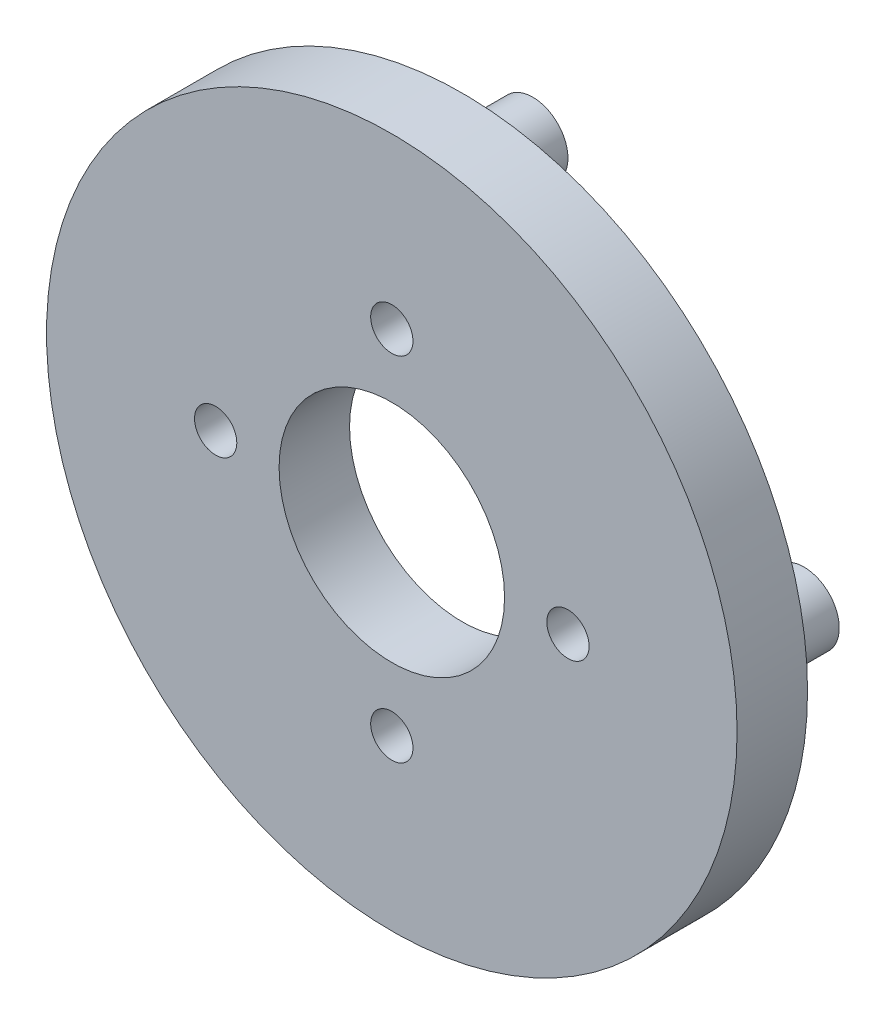
from build123d import *

# Parameters (mm, degrees)
SKETCH_1_R          = 24.5
SKETCH_1_R_2        = 1.5
EXTRUDE_1_DEPTH     = 5
SKETCH_2_R          = 2.5
EXTRUDE_2_DEPTH     = 5
SKETCH_4_R          = 1.25
CUT_EXTRUDE_1_DEPTH = 5
SKETCH_5_R          = 8
CUT_EXTRUDE_2_DEPTH = 5
SKETCH_6_R          = 2.5
CUT_EXTRUDE_3_DEPTH = 2


with BuildPart() as part:
    # 草图1 → 凸台-拉伸1 (new body)
    with BuildSketch(Plane.XY):
        Circle(SKETCH_1_R)
        with Locations((0, 12.5)):
            Circle(SKETCH_1_R_2, mode=Mode.SUBTRACT)
        with Locations((12.5, 0)):
            Circle(SKETCH_1_R_2, mode=Mode.SUBTRACT)
        with Locations((0, -12.5)):
            Circle(SKETCH_1_R_2, mode=Mode.SUBTRACT)
        with Locations((-12.5, 0)):
            Circle(SKETCH_1_R_2, mode=Mode.SUBTRACT)
    extrude(amount=EXTRUDE_1_DEPTH)

    # 草图2 → 凸台-拉伸2 (add)
    with BuildSketch(Plane.XY):
        with Locations((0, 19.25)):
            Circle(SKETCH_2_R)
        with Locations((19.25, 0)):
            Circle(SKETCH_2_R)
        with Locations((0, -19.25)):
            Circle(SKETCH_2_R)
        with Locations((-19.25, 0)):
            Circle(SKETCH_2_R)
    extrude(amount=-EXTRUDE_2_DEPTH)

    # 草图4 → 切除-拉伸1 (cut)
    with BuildSketch(Plane.XY):
        with Locations((0, 19.25)):
            Circle(SKETCH_4_R)
        with Locations((19.25, 0)):
            Circle(SKETCH_4_R)
        with Locations((0, -19.25)):
            Circle(SKETCH_4_R)
        with Locations((-19.25, 0)):
            Circle(SKETCH_4_R)
    extrude(amount=-CUT_EXTRUDE_1_DEPTH, mode=Mode.SUBTRACT)

    # 草图5 → 切除-拉伸2 (cut)
    with BuildSketch(Plane.XY):
        Circle(SKETCH_5_R)
    extrude(amount=CUT_EXTRUDE_2_DEPTH, mode=Mode.SUBTRACT)

    # 草图6 → 切除-拉伸3 (cut)
    with BuildSketch(Plane.XY):
        with Locations((0, 12.5)):
            Circle(SKETCH_6_R)
        with Locations((12.5, 0)):
            Circle(SKETCH_6_R)
        with Locations((0, -12.5)):
            Circle(SKETCH_6_R)
        with Locations((-12.5, 0)):
            Circle(SKETCH_6_R)
    extrude(amount=CUT_EXTRUDE_3_DEPTH, mode=Mode.SUBTRACT)


solid = part.part
